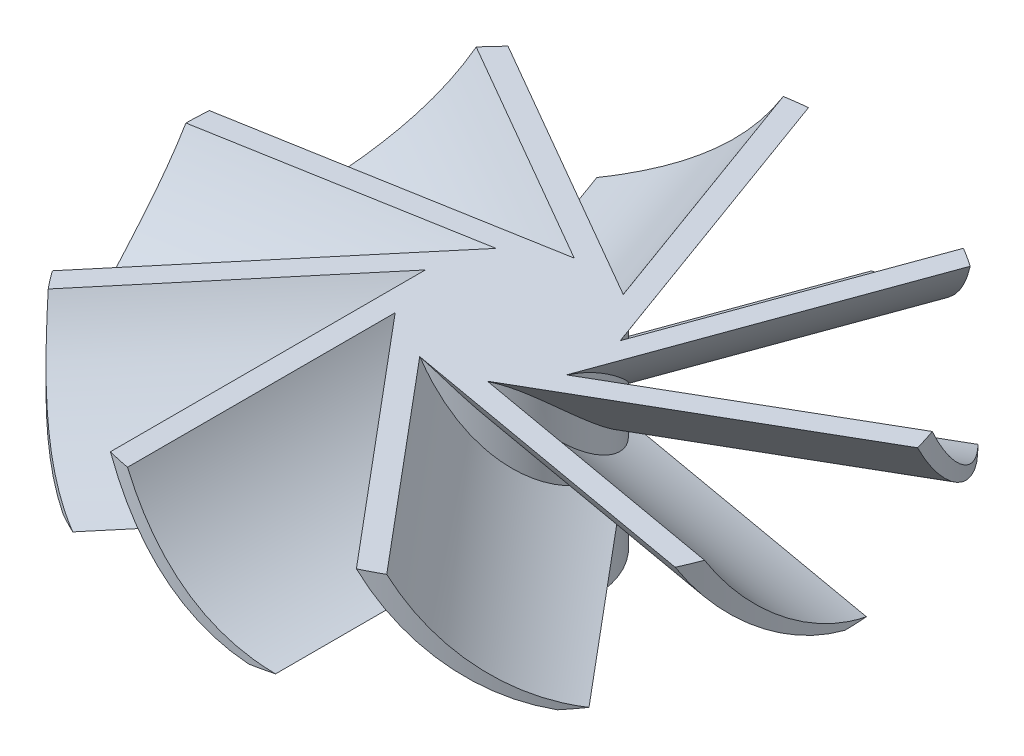
from build123d import *

# Parameters (mm, degrees)
BOSS_EXTRUDE1_DEPTH      = 5
BOSS_EXTRUDE1_DEPTH_BACK = 5
SKETCH1_R                = 7.5
BOSS_EXTRUDE2_DEPTH      = 45
CIRPATTERN1_COUNT        = 9
SKETCH4_R                = 130
SKETCH4_R_2              = 30
CUT_EXTRUDE1_DEPTH       = 45
BOSS_EXTRUDE3_START      = 8.4
SKETCH5_R                = 7.5
BOSS_EXTRUDE3_DEPTH      = 8.4
SKETCH8_W                = 2.1
SKETCH8_H                = 6.4
SKETCH8_H_2              = 6.5
CUT_EXTRUDE2_DEPTH       = 6.35
CUT_EXTRUDE3_DEPTH       = 8.4
CUT_EXTRUDE3_DEPTH_BACK  = 8.4
SKETCH10_R               = 1.9


with BuildPart() as part:
    # Sketch1 → Boss-Extrude1 (new, two sides: drawn at the far end of the back side and taken through both)
    with BuildSketch(Plane(origin=(0, 0, 0), x_dir=(1, 0, 0), z_dir=(0, 1, 0)).offset(-BOSS_EXTRUDE1_DEPTH_BACK)):
        Circle(SKETCH1_R)
    extrude(amount=BOSS_EXTRUDE1_DEPTH + BOSS_EXTRUDE1_DEPTH_BACK)

    # Sketch2 → Boss-Extrude2 (add)
    with BuildSketch(Plane.XY):
        with BuildLine():
            Line((-7.516126864, 5), (-5.516126864, 5))
            ThreePointArc((-5.516126864, 5), (0.005438163, -1.296138221), (7.516126864, -5))
            Line((7.516126864, -5), (5.516126864, -5))
            ThreePointArc((5.516126864, -5), (-1.994561837, -1.296138221), (-7.516126864, 5))
        make_face()
    boss_extrude2 = extrude(amount=BOSS_EXTRUDE2_DEPTH)

    # CirPattern1: Boss-Extrude2 ×9 about axis
    cirpattern1_axis = Axis((0, 0, 0), (0, 1, 0))
    for i in range(1, CIRPATTERN1_COUNT):
        add(boss_extrude2.rotate(cirpattern1_axis, i * 360 / CIRPATTERN1_COUNT))

    # Sketch4 → Cut-Extrude1 (cut)
    with BuildSketch(Plane(origin=(0, 5, 0), x_dir=(1, 0, 0), z_dir=(0, 1, 0))):
        Circle(SKETCH4_R)
        Circle(SKETCH4_R_2, mode=Mode.SUBTRACT)
    extrude(amount=-CUT_EXTRUDE1_DEPTH, mode=Mode.SUBTRACT)

    # Sketch5 → Boss-Extrude3 (add)
    with BuildSketch(Plane.XZ.offset(5).offset(BOSS_EXTRUDE3_START)):
        Circle(SKETCH5_R)
    extrude(amount=-BOSS_EXTRUDE3_DEPTH)

    # Sketch8 → Cut-Extrude2 (cut)
    with BuildSketch(Plane.XZ.offset(13.4)):
        with Locations((-3.55, 0)):
            Rectangle(SKETCH8_W, SKETCH8_H)
        with Locations((3.55, 0)):
            Rectangle(SKETCH8_W, SKETCH8_H_2)
        with BuildLine():
            Line((-0.625, -0.994987437), (-0.625, 0.994987437))
            ThreePointArc((-0.625, 0.994987437), (1.175, 0), (-0.625, -0.994987437))
        make_face()
    extrude(amount=-CUT_EXTRUDE2_DEPTH, mode=Mode.SUBTRACT)

    # Sketch10 → Cut-Extrude3 (cut, two sides: drawn at the far end of the back side and taken through both)
    with BuildSketch(Plane(origin=(0, 0, 0), x_dir=(0, 0, -1), z_dir=(1, 0, 0)).offset(-CUT_EXTRUDE3_DEPTH_BACK)):
        with Locations((0, -10.225)):
            Circle(SKETCH10_R)
    extrude(amount=CUT_EXTRUDE3_DEPTH + CUT_EXTRUDE3_DEPTH_BACK, mode=Mode.SUBTRACT)


solid = part.part
